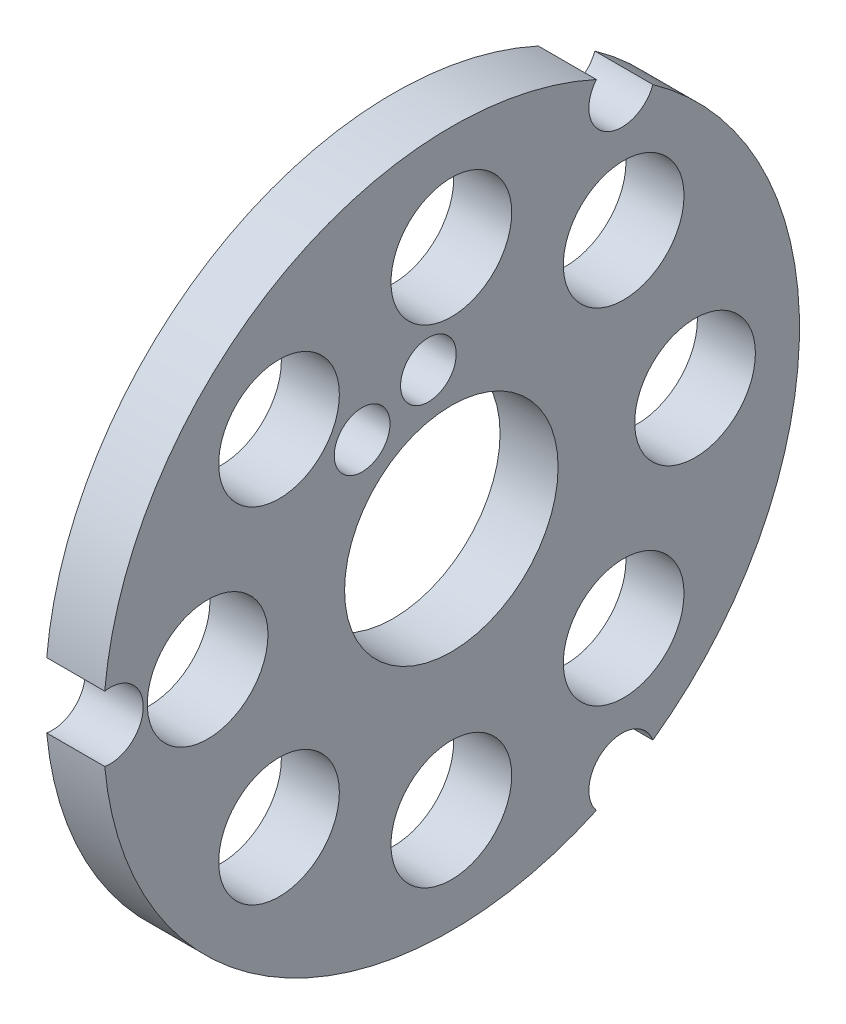
from build123d import *

# Parameters (mm, degrees)
AXIAL_PROFILE_MM_W     = 5
AXIAL_PROFILE_MM_H     = 20.8
AXIAL_HOLES_DEPTH      = 155.634051877
AXIAL_HOLES_DEPTH_BACK = 155.634051877
SKETCH2_R              = 5.2
SKETCH2_R_2            = 2.4
SKETCH2_R_3            = 2.85


with BuildPart() as part:
    # Axial profile (mm) → Full revolution (revolve)
    with BuildSketch(Plane.XY, mode=Mode.PRIVATE) as full_revolution_sk:
        with Locations((146.2, 19.6)):
            Rectangle(AXIAL_PROFILE_MM_W, AXIAL_PROFILE_MM_H)
    revolve(full_revolution_sk.sketch.rotate(Axis((-110, 0, 0), (1, 0, 0)), 90), axis=Axis((-110, 0, 0), (1, 0, 0)))

    # Sketch2 → Axial holes (cut, two sides: drawn at the far end of the back side and taken through both)
    with BuildSketch(Plane(origin=(0, 0, 0), x_dir=(0, 0, -1), z_dir=(1, 0, 0)).offset(-AXIAL_HOLES_DEPTH_BACK)):
        with Locations((0, 21)):
            Circle(SKETCH2_R)
        with Locations((-14.849242405, 14.849242405)):
            Circle(SKETCH2_R)
        with Locations((-21, 0)):
            Circle(SKETCH2_R)
        with Locations((-14.849242405, -14.849242405)):
            Circle(SKETCH2_R)
        with Locations((0, -21)):
            Circle(SKETCH2_R)
        with Locations((14.849242405, -14.849242405)):
            Circle(SKETCH2_R)
        with Locations((21, 0)):
            Circle(SKETCH2_R)
        with Locations((14.849242405, 14.849242405)):
            Circle(SKETCH2_R)
        with Locations((-1.977382665, 12.848733704)):
            Circle(SKETCH2_R_2)
        with Locations((-7.687206041, 10.483647423)):
            Circle(SKETCH2_R_2)
        with Locations((-29.4, 0)):
            Circle(SKETCH2_R_3)
        with Locations((14.7, -25.461146871)):
            Circle(SKETCH2_R_3)
        with Locations((14.7, 25.461146871)):
            Circle(SKETCH2_R_3)
    extrude(amount=AXIAL_HOLES_DEPTH + AXIAL_HOLES_DEPTH_BACK, mode=Mode.SUBTRACT)


solid = part.part
